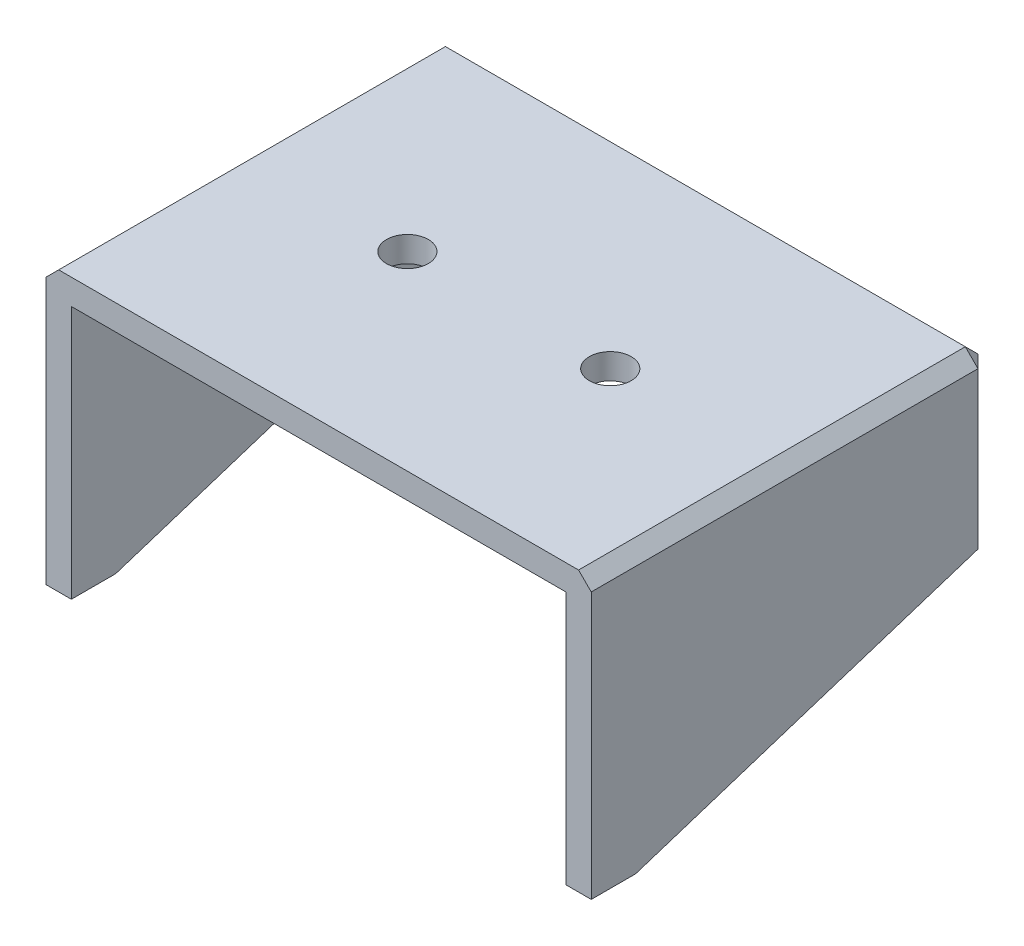
from build123d import *

# Parameters (mm, degrees)
SKETCH_1_W          = 43
SKETCH_1_H          = 31.5
EXTRUDE_1_DEPTH     = 2
SKETCH_4_W          = 2
SKETCH_4_H          = 31.5
EXTRUDE_3_DEPTH     = 20
SKETCH_7_W          = 39
SKETCH_7_H          = 1.5
EXTRUDE_4_DEPTH     = 11
SKETCH_6_R          = 1.65
CUT_EXTRUDE_2_DEPTH = 12
SKETCH_5_R          = 1.5
CUT_EXTRUDE_1_DEPTH = 12
CHAMFER_1_SIZE      = 1
CUT_EXTRUDE_4_DEPTH = 50
SKETCH_13_W         = 39
SKETCH_13_H         = 4
CUT_EXTRUDE_8_DEPTH = 10


with BuildPart() as part:
    # 草图1 → 凸台-拉伸1 (new body)
    with BuildSketch(Plane(origin=(0, 0, 0), x_dir=(1, 0, 0), z_dir=(0, 1, 0))):
        with Locations((0, -5.266908213)):
            Rectangle(SKETCH_1_W, SKETCH_1_H)
    extrude(amount=EXTRUDE_1_DEPTH)

    # 草图4 → 凸台-拉伸3 (add)
    with BuildSketch(Plane.XZ):
        with Locations((-20.5, 5.266908213)):
            Rectangle(SKETCH_4_W, SKETCH_4_H)
        with Locations((20.5, 5.266908213)):
            Rectangle(SKETCH_4_W, SKETCH_4_H)
    extrude(amount=EXTRUDE_3_DEPTH)

    # 草图7 → 凸台-拉伸4 (add)
    with BuildSketch(Plane.XZ):
        with Locations((0, -9.733091787)):
            Rectangle(SKETCH_7_W, SKETCH_7_H)
    extrude(amount=EXTRUDE_4_DEPTH)

    # 草图6 → 切除-拉伸2 (cut)
    with BuildSketch(Plane.XZ):
        with Locations(Location((8, 6.016908213, 0), (0, 0, 270))):
            Circle(SKETCH_6_R)
        with Locations(Location((-8, 6.016908213, 0), (0, 0, 270))):
            Circle(SKETCH_6_R)
    extrude(amount=-CUT_EXTRUDE_2_DEPTH, mode=Mode.SUBTRACT)

    # 草图5 → 切除-拉伸1 (cut)
    with BuildSketch(Plane(origin=(0, 0, -10.483091787), x_dir=(-1, 0, 0), z_dir=(0, 0, -1))):
        with Locations((-13, -3)):
            Circle(SKETCH_5_R)
        with Locations((13, -3)):
            Circle(SKETCH_5_R)
    extrude(amount=-CUT_EXTRUDE_1_DEPTH, mode=Mode.SUBTRACT)

    # 倒角1
    chamfer_1_edges = [part.edges().sort_by_distance(p)[0] for p in [
        (21.5, 2, 5.266908213),
        (0, 2, -10.483091787),
        (-21.5, 2, 5.266908213),
        (-21.5, -9, -10.483091787),
        (21.5, -9, -10.483091787),
    ]]
    chamfer(chamfer_1_edges, length=CHAMFER_1_SIZE)

    # 草图10 → 切除-拉伸4 (cut, symmetric)
    with BuildSketch(Plane(origin=(-19.5, 0, 0), x_dir=(0, 0, -1), z_dir=(1, 0, 0))):
        Polygon((10.483091787, -20), (10.483091787, -11), (-17.516908213, -20), align=None)
    extrude(amount=CUT_EXTRUDE_4_DEPTH, both=True, mode=Mode.SUBTRACT)

    # 草图13 → 切除-拉伸8 (cut)
    with BuildSketch(Plane(origin=(0, 0, -10.483091787), x_dir=(-1, 0, 0), z_dir=(0, 0, -1))):
        with Locations((0, -9)):
            Rectangle(SKETCH_13_W, SKETCH_13_H)
    extrude(amount=-CUT_EXTRUDE_8_DEPTH, mode=Mode.SUBTRACT)


solid = part.part
